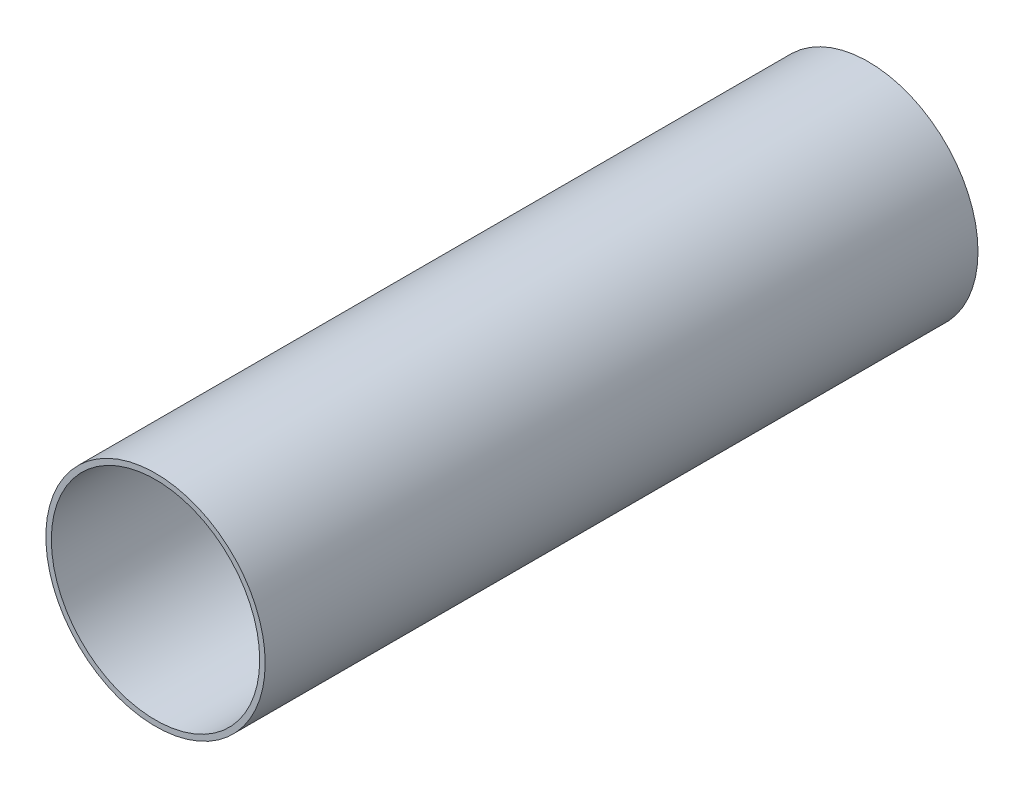
from build123d import *

# Parameters (mm, degrees)
SKETCH1_R           = 20
SKETCH1_R_2         = 19
BOSS_EXTRUDE1_DEPTH = 65


with BuildPart() as part:
    # Sketch1 → Boss-Extrude1 (new, symmetric)
    with BuildSketch(Plane.XY):
        Circle(SKETCH1_R)
        Circle(SKETCH1_R_2, mode=Mode.SUBTRACT)
    extrude(amount=BOSS_EXTRUDE1_DEPTH, both=True)


solid = part.part
